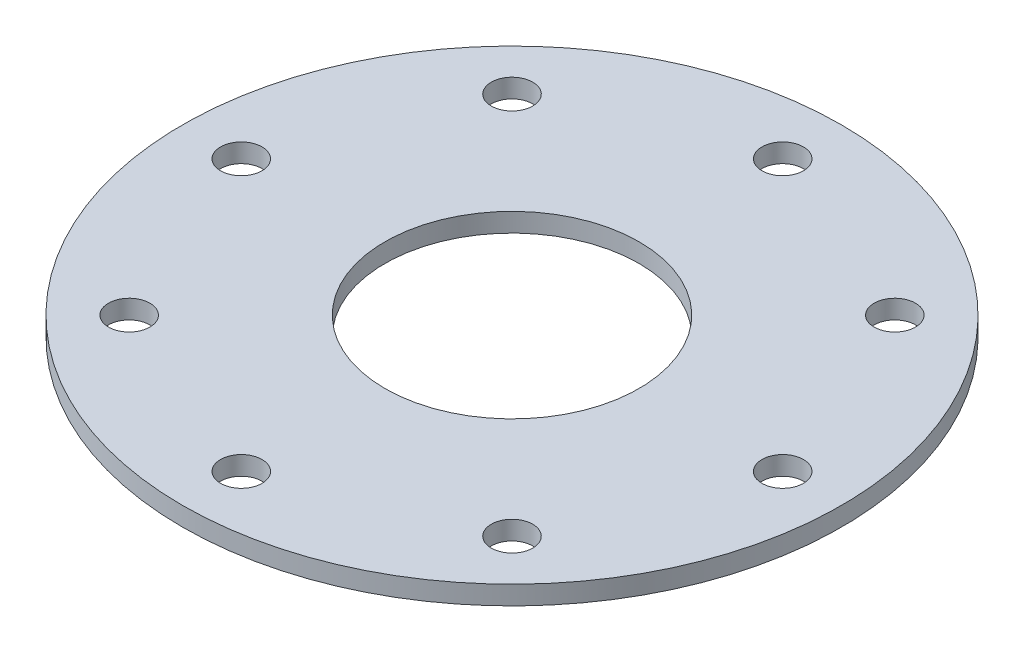
from build123d import *

# Parameters (mm, degrees)
SKETCH_1_R      = 70
SKETCH_1_R_2    = 27
SKETCH_1_R_3    = 4.4
EXTRUDE_1_DEPTH = 4


with BuildPart() as part:
    # Эскиз1 → Бобышка-Вытянуть1 (new body)
    with BuildSketch(Plane(origin=(0, 0, 0), x_dir=(1, 0, 0), z_dir=(0, 1, 0))):
        with Locations(Location((0, 0, 0), (0, 0, 90))):
            Circle(SKETCH_1_R)
        with Locations(Location((0, 0, 0), (0, 0, 90))):
            Circle(SKETCH_1_R_2, mode=Mode.SUBTRACT)
        with Locations(Location((57.5, 0, 0), (0, 0, 90))):
            Circle(SKETCH_1_R_3, mode=Mode.SUBTRACT)
        with Locations(Location((40.658639918, -40.658639918, 0), (0, 0, 90))):
            Circle(SKETCH_1_R_3, mode=Mode.SUBTRACT)
        with Locations(Location((0, -57.5, 0), (0, 0, 90))):
            Circle(SKETCH_1_R_3, mode=Mode.SUBTRACT)
        with Locations(Location((-40.658639918, -40.658639918, 0), (0, 0, 90))):
            Circle(SKETCH_1_R_3, mode=Mode.SUBTRACT)
        with Locations(Location((-57.5, 0, 0), (0, 0, 90))):
            Circle(SKETCH_1_R_3, mode=Mode.SUBTRACT)
        with Locations(Location((-40.658639918, 40.658639918, 0), (0, 0, 90))):
            Circle(SKETCH_1_R_3, mode=Mode.SUBTRACT)
        with Locations(Location((0, 57.5, 0), (0, 0, 90))):
            Circle(SKETCH_1_R_3, mode=Mode.SUBTRACT)
        with Locations(Location((40.658639918, 40.658639918, 0), (0, 0, 90))):
            Circle(SKETCH_1_R_3, mode=Mode.SUBTRACT)
    extrude(amount=EXTRUDE_1_DEPTH)


solid = part.part
